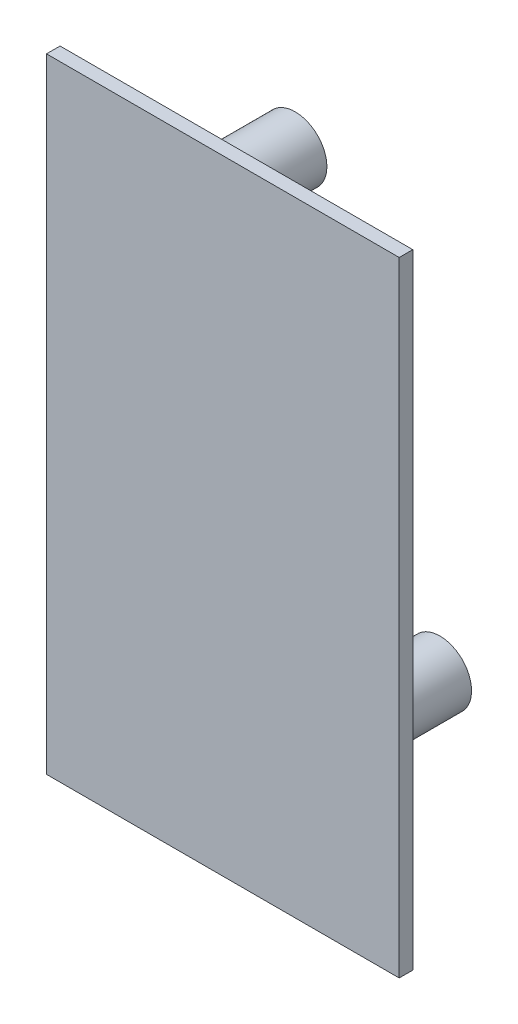
from build123d import *

# Parameters (mm, degrees)
SKETCH_1_W      = 39
SKETCH_1_H      = 69
EXTRUDE_1_DEPTH = 1.5
SKETCH_2_R      = 3.5
SKETCH_2_R_2    = 1.5
EXTRUDE_2_DEPTH = 7


with BuildPart() as part:
    # Эскиз1 → Бобышка-Вытянуть1 (new body)
    with BuildSketch(Plane.XY):
        with Locations((19.5, 34.5)):
            Rectangle(SKETCH_1_W, SKETCH_1_H)
    extrude(amount=EXTRUDE_1_DEPTH)

    # Эскиз2 → Бобышка-Вытянуть2 (add)
    # profile 1 of 3: a face of its own
    with BuildSketch(Plane(origin=(0, 0, 0), x_dir=(-1, 0, 0), z_dir=(0, 0, -1))):
        with Locations((-19, 65.2)):
            Circle(SKETCH_2_R)
        with Locations((-19, 65.2)):
            Circle(SKETCH_2_R_2, mode=Mode.SUBTRACT)
    # profile 2 of 3: a face of its own
    with BuildSketch(Plane(origin=(0, 0, 0), x_dir=(-1, 0, 0), z_dir=(0, 0, -1))):
        with Locations((-35, 23)):
            Circle(SKETCH_2_R)
        with Locations((-35, 23)):
            Circle(SKETCH_2_R_2, mode=Mode.SUBTRACT)
    # profile 3 of 3: a face of its own
    with BuildSketch(Plane(origin=(0, 0, 0), x_dir=(-1, 0, 0), z_dir=(0, 0, -1))):
        with Locations((-19, 12.2)):
            Circle(SKETCH_2_R)
        with Locations((-19, 12.2)):
            Circle(SKETCH_2_R_2, mode=Mode.SUBTRACT)
    extrude(amount=EXTRUDE_2_DEPTH)


solid = part.part
